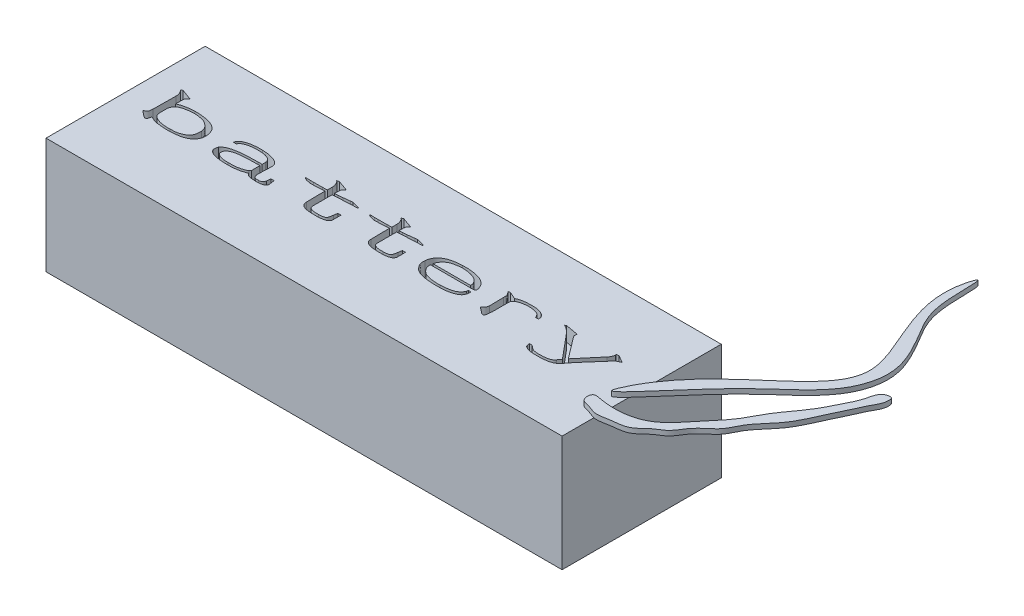
from build123d import *

# Parameters (mm, degrees)
SKETCH_1_W          = 107
SKETCH_1_H          = 33
EXTRUDE_1_DEPTH     = 24
EXTRUDE_2_DEPTH     = 1
CUT_EXTRUDE_1_DEPTH = 3


with BuildPart() as part:
    # 草图1 → 凸台-拉伸1 (new body)
    with BuildSketch(Plane(origin=(0, 0, 0), x_dir=(1, 0, 0), z_dir=(0, 1, 0))):
        Rectangle(SKETCH_1_W, SKETCH_1_H)
    extrude(amount=EXTRUDE_1_DEPTH)

    # 草图3 → 凸台-拉伸2 (add)
    with BuildSketch(Plane(origin=(0, 24, 0), x_dir=(1, 0, 0), z_dir=(0, 1, 0))):
        with BuildLine():
            add(Edge.make_bspline(
                [(52.795778293, -0.83675297), (59.844864524, 12.263734375), (85.832025443, 21.143971096), (65.671648546, 42.39713603), (69.977335362, 55.335078079), (69.598482649, 44.173440129), (72.431088504, 38.949802551), (78.487801167, 29.393472645), (75.530838449, 19.368679502), (66.103384067, 11.385991546), (61.050014322, 6.17936512), (49.979680642, -6.816970783), (52.092492679, -2.143785398), (52.795778293, -0.83675297)],
                knots=[0, 0, 0, 0, 0.257085536, 0.455034682, 0.465271925, 0.505328889, 0.579342725, 0.660886885, 0.722727264, 0.797250864, 0.913610995, 0.974350639, 1, 1, 1, 1], degree=3))
        make_face()
        with BuildLine():
            add(Edge.make_bspline(
                [(51.439943779, -6.787963002), (55.342352136, -7.517123566), (61.145035103, -6.954867424), (65.974307534, -0.566733036), (69.555996551, 3.342184148), (72.161897367, 8.878801404), (75.593409122, 12.731492289), (77.712546708, 17.384926835), (79.264043929, 20.20897008), (79.570462434, 23.095432505), (81.020764394, 23.573706878), (81.871270224, 23.706842843), (82.151942425, 21.731129555), (80.875315277, 20.134677165), (79.82026716, 17.376158755), (77.789063936, 13.552118806), (75.757271361, 7.95021169), (71.501657107, 4.184222408), (69.805439686, -0.173914348), (66.426467368, -2.056432107), (64.960788475, -5.494048863), (62.642985047, -6.624437368), (61.363396171, -7.921070397), (59.468831096, -9.500575575), (57.096869903, -9.46376914), (54.972932664, -9.945712676), (53.275468062, -10.070543491), (51.944508448, -9.212151302), (50.711041659, -9.10537921), (49.817582731, -8.411445786), (49.963897019, -6.482756841), (51.039417889, -6.713125195), (51.439943779, -6.787963002)],
                knots=[0, 0, 0, 0, 0.105259423, 0.165749622, 0.232821888, 0.265985133, 0.349341424, 0.387282205, 0.418309659, 0.451065362, 0.458174799, 0.464842638, 0.472483702, 0.506709597, 0.526789284, 0.56110242, 0.638059267, 0.703277407, 0.727657663, 0.776021908, 0.812732245, 0.8341436, 0.851342923, 0.868011488, 0.906931799, 0.918078239, 0.934531931, 0.956495227, 0.963717099, 0.971154977, 0.98919664, 1, 1, 1, 1], degree=3))
        make_face()
    extrude(amount=EXTRUDE_2_DEPTH)

    # 草图4 → 切除-拉伸1 (cut)
    # profile 1 of 7: a face of its own
    with BuildSketch(Plane(origin=(0, 24, 0), x_dir=(1, 0, 0), z_dir=(0, 1, 0))):
        with BuildLine():
            add(Edge.make_bspline(
                [(-46.315980853, -1.712589925), (-46.338242193, -1.764888924), (-46.379539331, -1.861909095), (-46.428689536, -2.000779299), (-46.457447372, -2.122520942), (-46.466603588, -2.227942485), (-46.468088336, -2.319821817), (-46.488491676, -2.401278121), (-46.521247955, -2.474029145), (-46.56240621, -2.538820816), (-46.616739613, -2.588262798), (-46.677084684, -2.624592555), (-46.747078199, -2.638250215), (-46.794095471, -2.633259754), (-46.818370913, -2.630683133)],
                knots=[0, 0, 0, 0, 1.772904811, 3.288925831, 4.591085337, 5.661310779, 6.585261859, 7.449842412, 8.256927572, 9.06945469, 9.823301038, 10.529723387, 11.240882905, 12, 12, 12, 12], degree=3))
            add(Edge.make_bspline(
                [(-46.818370913, -2.630683133), (-46.820991341, -2.629995072), (-46.831343531, -2.627276835), (-46.855338396, -2.624459925), (-46.89453847, -2.615462196), (-46.967586453, -2.601721587), (-47.068108463, -2.564642756), (-47.136176533, -2.510595074), (-47.171029034, -2.482921351)],
                knots=[0, 0, 0, 0, 0.125575752, 0.496096203, 1.11729126, 1.98943537, 3.946493689, 6, 6, 6, 6], degree=3))
            Line((-47.171029034, -2.482921351), (-47.421238986, -2.311517683))
            Line((-47.421238986, -2.311517683), (-48.12458507, -1.751993067))
            add(Edge.make_bspline(
                [(-48.12458507, -1.751993067), (-48.161381046, -1.722458398), (-48.225395345, -1.671076659), (-48.298856845, -1.598081398), (-48.347245439, -1.547692035), (-48.356500677, -1.49828505), (-48.328291878, -1.465395377), (-48.290721799, -1.433664652), (-48.239431973, -1.393172292), (-48.145021537, -1.336229072), (-48.019016746, -1.245090531), (-47.896028416, -1.139380805), (-47.809380559, -1.044361429), (-47.753583944, -0.976106472), (-47.717359814, -0.906126384), (-47.695456865, -0.829110891), (-47.683648452, -0.730136447), (-47.66500127, -0.593711093), (-47.643520623, -0.410488038), (-47.629821554, -0.272429105), (-47.62219501, -0.195568959)],
                knots=[0, 0, 0, 0, 1.309150132, 2.277540628, 2.891037881, 3.221713804, 3.550874015, 4.01637685, 4.615300949, 5.35471479, 7.082438118, 8.932324813, 9.849804258, 10.656905344, 11.375512208, 12.022595925, 12.872156994, 14.142666868, 15.852546144, 18, 18, 18, 18], degree=3))
            Line((-47.62219501, -0.195568959), (-47.572941082, 4.564330592))
            add(Edge.make_bspline(
                [(-47.572941082, 4.564330592), (-47.575322265, 4.665188265), (-47.579833525, 4.856267783), (-47.64147465, 5.127384711), (-47.730949766, 5.375437242), (-47.824445747, 5.568312263), (-47.905319548, 5.708230335), (-47.951143761, 5.79774945), (-47.990622069, 5.866331325), (-48.014208064, 5.905380129), (-48.024107058, 5.921768833)],
                knots=[0, 0, 0, 0, 1.664739368, 3.1539256, 4.572845527, 6.020534025, 6.69151302, 7.24546857, 7.68332469, 8, 8, 8, 8], degree=3))
            Line((-48.024107058, 5.921768833), (-48.276287167, 6.1345458))
            Line((-48.276287167, 6.1345458), (-47.823151034, 6.266546326))
            Line((-47.823151034, 6.266546326), (-45.612634769, 5.468632701))
            add(Edge.make_bspline(
                [(-45.612634769, 5.468632701), (-45.660111652, 5.426699286), (-45.750268398, 5.347069368), (-45.890278258, 5.238838143), (-46.018089576, 5.114577968), (-46.106656999, 4.982303833), (-46.164032554, 4.848551577), (-46.193689271, 4.718019233), (-46.213281939, 4.562962341), (-46.214730242, 4.450793448), (-46.215502841, 4.390956767)],
                knots=[0, 0, 0, 0, 1.167370995, 2.216791929, 3.261172925, 4.439727147, 5.123281863, 5.933685907, 6.897721357, 8, 8, 8, 8], degree=3))
            Line((-46.215502841, 4.390956767), (-46.215502841, 3.074891825))
            add(Edge.make_bspline(
                [(-46.215502841, 3.074891825), (-46.139858501, 3.105455761), (-45.971944068, 3.173301232), (-45.747519574, 3.270989584), (-45.516491934, 3.354536921), (-45.280581128, 3.426539502), (-44.987621307, 3.501844243), (-44.643101416, 3.58531474), (-44.250415043, 3.661468237), (-43.816659654, 3.723134309), (-43.344863676, 3.760507071), (-43.0179918, 3.773480941), (-42.848504359, 3.780208067)],
                knots=[0, 0, 0, 0, 0.706616079, 1.56853822, 2.119110147, 2.833353726, 3.703884378, 4.738579347, 5.903148453, 7.166825923, 8.53096133, 10, 10, 10, 10], degree=3))
            add(Edge.make_bspline(
                [(-42.848504359, 3.780208067), (-42.649473628, 3.781856437), (-42.255035108, 3.785123172), (-41.669735416, 3.749621063), (-41.096774798, 3.687565121), (-40.630847804, 3.609293309), (-40.271781059, 3.531258874), (-40.016795879, 3.473878751), (-39.777669911, 3.40762507), (-39.551954615, 3.342463153), (-39.343839475, 3.268256134), (-39.148925892, 3.194561454), (-38.970336157, 3.112942798), (-38.755683693, 3.006340331), (-38.520152736, 2.868985879), (-38.275140604, 2.701281968), (-38.074603196, 2.536263996), (-37.921881096, 2.360720901), (-37.796114068, 2.179372219), (-37.685878094, 1.981955814), (-37.583767022, 1.765439393), (-37.491562305, 1.530026143), (-37.413132417, 1.278767692), (-37.350666012, 1.013741689), (-37.313420842, 0.73524858), (-37.290571123, 0.448546301), (-37.291711218, 0.15828997), (-37.333157188, -0.127760659), (-37.403910651, -0.408167494), (-37.480628219, -0.585227618), (-37.519229406, -0.674317134)],
                knots=[0, 0, 0, 0, 1.975545378, 3.915130053, 5.817381957, 7.695298933, 8.601942458, 9.465456075, 10.289471349, 11.06509479, 11.797098768, 12.482403687, 13.133155347, 13.745472335, 14.861502225, 15.83631147, 16.692011666, 17.43109529, 18.138288337, 18.879869697, 19.67315892, 20.513419053, 21.387768748, 22.284512063, 23.213022305, 24.174129613, 25.139165318, 26.087045441, 27.037478389, 28, 28, 28, 28], degree=3))
            add(Edge.make_bspline(
                [(-37.519229406, -0.674317134), (-37.572114015, -0.768370133), (-37.676687833, -0.954350165), (-37.872665499, -1.20642572), (-38.096651251, -1.43039915), (-38.347759746, -1.625518627), (-38.621136424, -1.790952745), (-38.908359684, -1.938444393), (-39.212104958, -2.062747047), (-39.533219568, -2.162047686), (-39.869128292, -2.244259783), (-40.219801412, -2.312222313), (-40.585643966, -2.370423062), (-40.96253455, -2.411627178), (-41.338994635, -2.443021209), (-41.704969046, -2.462368738), (-42.055122538, -2.473133873), (-42.283719716, -2.471767671), (-42.395368226, -2.471100408)],
                knots=[0, 0, 0, 0, 0.946821189, 1.872240517, 2.794146846, 3.723101712, 4.658109279, 5.597236624, 6.557113699, 7.536893828, 8.547094745, 9.593622374, 10.673902707, 11.800243469, 12.923210794, 13.992016167, 15.019286222, 16, 16, 16, 16], degree=3))
            add(Edge.make_bspline(
                [(-42.395368226, -2.471100408), (-42.54841218, -2.469538431), (-42.85861573, -2.46637247), (-43.330378127, -2.44156932), (-43.81453966, -2.401928181), (-44.22173111, -2.357679983), (-44.54053976, -2.313078371), (-44.761532167, -2.278509046), (-44.961850562, -2.239139034), (-45.141826779, -2.197594965), (-45.301619404, -2.155774044), (-45.439985619, -2.107752597), (-45.559250831, -2.059905839), (-45.629340191, -2.02184711), (-45.661888696, -2.004173176)],
                knots=[0, 0, 0, 0, 1.658668106, 3.36194093, 5.118671966, 6.923369988, 7.800119057, 8.607530892, 9.347360781, 10.012094373, 10.609514821, 11.136224507, 11.598874906, 12, 12, 12, 12], degree=3))
            Line((-45.661888696, -2.004173176), (-46.315980853, -1.712589925))
        make_face()
        with BuildLine():
            add(Edge.make_bspline(
                [(-46.264756769, -0.035986234), (-46.264517125, -0.093838706), (-46.264053176, -0.205841124), (-46.245865218, -0.367316434), (-46.226775061, -0.517391167), (-46.193037891, -0.655713148), (-46.144353201, -0.785395807), (-46.079838425, -0.91031024), (-45.99232982, -1.029210547), (-45.88647526, -1.149353418), (-45.745105866, -1.265933619), (-45.563782534, -1.381067609), (-45.339397962, -1.497896408), (-45.077944136, -1.618481969), (-44.785787894, -1.731221223), (-44.472154572, -1.825291779), (-44.142921848, -1.900080434), (-43.798142, -1.956875393), (-43.435673018, -1.995672186), (-43.055050673, -2.018993658), (-42.655420185, -2.026594761), (-42.38288336, -2.020882309), (-42.243666129, -2.017964276)],
                knots=[0, 0, 0, 0, 0.689292554, 1.334470774, 1.935816662, 2.492302953, 3.027557294, 3.584484192, 4.162536561, 4.78359734, 5.489460419, 6.338737431, 7.340627001, 8.503949449, 9.770635974, 11.071240543, 12.404785865, 13.793873196, 15.235451237, 16.74972339, 18.339694061, 20, 20, 20, 20], degree=3))
            add(Edge.make_bspline(
                [(-42.243666129, -2.017964276), (-42.136590971, -2.016908093), (-41.92491879, -2.014820171), (-41.612856304, -1.995913329), (-41.309604793, -1.969685755), (-41.014964904, -1.927903515), (-40.724490331, -1.872192334), (-40.439453951, -1.790874486), (-40.158042219, -1.687219357), (-39.88324856, -1.565348286), (-39.625317969, -1.424960473), (-39.394184252, -1.268146495), (-39.19315431, -1.099645468), (-39.02617205, -0.913793419), (-38.887521186, -0.716512257), (-38.78537427, -0.502231324), (-38.709463868, -0.276192264), (-38.665546475, 0.03772906), (-38.634187668, 0.415102954), (-38.628942861, 0.713251848), (-38.626457696, 0.854524775)],
                knots=[0, 0, 0, 0, 1.07945318, 2.133923623, 3.151213363, 4.14753613, 5.133130334, 6.130860213, 7.132143007, 8.154698424, 9.15925975, 10.088531434, 10.966870054, 11.796647512, 12.601100282, 13.388811291, 14.182399994, 14.994446716, 16.575868246, 18, 18, 18, 18], degree=3))
            add(Edge.make_bspline(
                [(-38.626457696, 0.854524775), (-38.636758576, 0.946182269), (-38.656675794, 1.123406194), (-38.720977571, 1.374387963), (-38.806268909, 1.603084689), (-38.925260392, 1.80874349), (-39.070986957, 2.002294081), (-39.243559572, 2.194980673), (-39.450115888, 2.384948019), (-39.684367905, 2.575160466), (-39.948777022, 2.757062492), (-40.250550826, 2.906907582), (-40.582355314, 3.032509481), (-40.941508907, 3.124201908), (-41.314068011, 3.198042103), (-41.690854795, 3.253170588), (-42.06764007, 3.289821511), (-42.319110022, 3.297585018), (-42.444622154, 3.301459892)],
                knots=[0, 0, 0, 0, 0.886766497, 1.714603255, 2.486987939, 3.228656879, 3.992223533, 4.815826547, 5.714742169, 6.690057925, 7.71913229, 8.796144482, 9.924338822, 11.127906722, 12.358848346, 13.579032064, 14.791661409, 16, 16, 16, 16], degree=3))
            add(Edge.make_bspline(
                [(-42.444622154, 3.301459892), (-42.623977801, 3.298778699), (-42.972632261, 3.293566655), (-43.479954633, 3.254288443), (-43.955759481, 3.188022337), (-44.329298957, 3.109796112), (-44.607414367, 3.037978546), (-44.795370186, 2.982154457), (-44.968197461, 2.92988404), (-45.124043388, 2.874778435), (-45.263360591, 2.818077235), (-45.38631715, 2.760821621), (-45.49307364, 2.703936285), (-45.614055749, 2.628773918), (-45.74285456, 2.520001946), (-45.881627832, 2.375819862), (-45.997591523, 2.208864794), (-46.090101657, 2.029507855), (-46.162742378, 1.856833121), (-46.220065115, 1.70719921), (-46.254222773, 1.584266309), (-46.261587394, 1.510716731), (-46.264756769, 1.479064575)],
                knots=[0, 0, 0, 0, 2.325357788, 4.520328062, 6.592763197, 8.549990043, 9.46490639, 10.316405931, 11.092065462, 11.805752128, 12.458802872, 13.041629272, 13.563550566, 14.026581579, 14.885710438, 15.741033144, 16.61509649, 17.510184124, 18.353211674, 19.042873738, 19.588099474, 20, 20, 20, 20], degree=3))
            Line((-46.264756769, 1.479064575), (-46.264756769, -0.035986234))
        make_face(mode=Mode.SUBTRACT)
    # profile 2 of 7: a face of its own
    with BuildSketch(Plane(origin=(0, 24, 0), x_dir=(1, 0, 0), z_dir=(0, 1, 0))):
        with BuildLine():
            Line((-22.871111375, -0.489122367), (-22.217019218, -0.489122367))
            add(Edge.make_bspline(
                [(-22.217019218, -0.489122367), (-22.209648142, -0.532437323), (-22.195936208, -0.613013326), (-22.179037119, -0.725180571), (-22.171700811, -0.81937159), (-22.168970367, -0.875925313), (-22.167765291, -0.9008852)],
                knots=[0, 0, 0, 0, 1.270321599, 2.363096856, 3.277555622, 4, 4, 4, 4], degree=3))
            Line((-22.167765291, -0.9008852), (-22.067287279, -1.698798826))
            add(Edge.make_bspline(
                [(-22.067287279, -1.698798826), (-22.069313129, -1.738988292), (-22.073281734, -1.817718758), (-22.100403421, -1.931267163), (-22.149914163, -2.034142497), (-22.218164862, -2.132241479), (-22.327088869, -2.2188592), (-22.481930752, -2.29094011), (-22.684228732, -2.358697481), (-22.931567726, -2.417155253), (-23.212745179, -2.462872487), (-23.517334651, -2.494017586), (-23.840902256, -2.509977985), (-24.175542403, -2.506676704), (-24.50346454, -2.491670386), (-24.80826601, -2.465575048), (-25.082224242, -2.434076692), (-25.324010355, -2.38965692), (-25.532251028, -2.334552508), (-25.704343204, -2.264749631), (-25.841606948, -2.179744167), (-25.906557107, -2.105559473), (-25.936675821, -2.071158517)],
                knots=[0, 0, 0, 0, 0.554544918, 1.086343844, 1.597038661, 2.122626584, 2.721237962, 3.491115133, 4.468181419, 5.661454917, 6.993103929, 8.395933712, 9.883624887, 11.460180385, 13.011222913, 14.411504783, 15.680300313, 16.814059939, 17.801032354, 18.645752208, 19.372007666, 20, 20, 20, 20], degree=3))
            Line((-25.936675821, -2.071158517), (-26.18885593, -1.818978409))
            add(Edge.make_bspline(
                [(-26.18885593, -1.818978409), (-26.414125353, -1.896425987), (-26.878094785, -2.055938577), (-27.415699842, -2.209676079), (-27.800881835, -2.298624786), (-28.022275375, -2.340002415), (-28.265533893, -2.374791518), (-28.531079333, -2.403773089), (-28.818061542, -2.429660783), (-29.128147814, -2.449074801), (-29.459896855, -2.462280984), (-29.68850326, -2.468105265), (-29.806064363, -2.471100408)],
                knots=[0, 0, 0, 0, 1.932578683, 3.980377894, 4.532294502, 5.139442516, 5.80705343, 6.525480165, 7.306462626, 8.144671838, 9.045895386, 10, 10, 10, 10], degree=3))
            add(Edge.make_bspline(
                [(-29.806064363, -2.471100408), (-29.963680112, -2.473560564), (-30.275672882, -2.478430324), (-30.739588292, -2.46562688), (-31.194499205, -2.439348316), (-31.634606981, -2.393350832), (-32.050091756, -2.337744674), (-32.428205005, -2.26135567), (-32.767676607, -2.179424986), (-33.065127146, -2.079171931), (-33.323043163, -1.967751724), (-33.544674374, -1.853617128), (-33.729092624, -1.730710848), (-33.878907992, -1.600308905), (-33.993591434, -1.455270744), (-34.070959499, -1.293412564), (-34.119859561, -1.116627622), (-34.131682818, -0.927909613), (-34.125408767, -0.74013306), (-34.105737553, -0.56236468), (-34.075431224, -0.399141906), (-34.043530228, -0.297763831), (-34.028111027, -0.248763201)],
                knots=[0, 0, 0, 0, 1.668168946, 3.302059948, 4.910562789, 6.489480886, 7.984541388, 9.344915788, 10.570446142, 11.678211212, 12.662039313, 13.541897603, 14.312991836, 15.002174979, 15.636154712, 16.254745884, 16.888725616, 17.56520954, 18.246673955, 18.876065113, 19.456751202, 20, 20, 20, 20], degree=3))
            add(Edge.make_bspline(
                [(-34.028111027, -0.248763201), (-33.996646543, -0.202345532), (-33.926539212, -0.098920385), (-33.776870028, 0.044876263), (-33.580052743, 0.1929486), (-33.388210845, 0.323566697), (-33.205258239, 0.424252755), (-33.046842607, 0.50217569), (-32.869401059, 0.574060145), (-32.674085189, 0.642831038), (-32.460502112, 0.708088851), (-32.228644961, 0.767620454), (-31.979439383, 0.827925142), (-31.619868957, 0.90070231), (-31.149556554, 0.981627784), (-30.567683114, 1.05527442), (-29.967836401, 1.11163831), (-29.361019751, 1.141603001), (-28.773066614, 1.161049887), (-28.229350582, 1.18000962), (-27.742681587, 1.191510532), (-27.437281327, 1.196815414), (-27.294114062, 1.199302267)],
                knots=[0, 0, 0, 0, 0.474568784, 1.057406525, 1.748090082, 2.563665213, 3.022381192, 3.518049277, 4.059991523, 4.644794997, 5.273731974, 5.953209925, 6.674558467, 7.447869958, 9.06389936, 10.720418691, 12.420653509, 14.171976133, 15.871718322, 17.409663331, 18.785687298, 20, 20, 20, 20], degree=3))
            Line((-27.294114062, 1.199302267), (-26.389811954, 1.213093367))
            Line((-26.389811954, 1.213093367), (-26.389811954, 1.890827409))
            add(Edge.make_bspline(
                [(-26.389811954, 1.890827409), (-26.392359395, 1.94561894), (-26.397503372, 2.056257963), (-26.443314816, 2.218740414), (-26.515616354, 2.376501093), (-26.614444293, 2.527930486), (-26.7399112, 2.671029228), (-26.891506302, 2.800889481), (-27.070632785, 2.913232142), (-27.271370954, 3.013185299), (-27.494615327, 3.099004563), (-27.737450416, 3.172232235), (-27.999918693, 3.228207338), (-28.279636669, 3.270697898), (-28.576124717, 3.302368567), (-28.888400845, 3.320747514), (-29.216920028, 3.331749108), (-29.4409219, 3.328657962), (-29.555854412, 3.327071934)],
                knots=[0, 0, 0, 0, 0.685409922, 1.384029301, 2.09841458, 2.853891613, 3.641145785, 4.475663167, 5.345343854, 6.283744758, 7.281595889, 8.338532371, 9.458668871, 10.641090145, 11.882402854, 13.193357309, 14.559947325, 16, 16, 16, 16], degree=3))
            add(Edge.make_bspline(
                [(-29.555854412, 3.327071934), (-29.708282876, 3.32180335), (-30.001679059, 3.311662315), (-30.422444166, 3.276326081), (-30.806686757, 3.226198079), (-31.153672971, 3.158809209), (-31.46740982, 3.081104278), (-31.747780138, 2.988482954), (-31.997652622, 2.88514815), (-32.210485911, 2.770635706), (-32.383155445, 2.658537217), (-32.509845117, 2.561743567), (-32.595856098, 2.479826165), (-32.614271391, 2.42027225), (-32.621418858, 2.397157783)],
                knots=[0, 0, 0, 0, 1.661382121, 3.197848749, 4.598228732, 5.880699166, 7.046770766, 8.116910757, 9.094879633, 9.987930397, 10.747957822, 11.329014914, 11.739572752, 12, 12, 12, 12], degree=3))
            Line((-32.621418858, 2.397157783), (-32.670672785, 2.198171916))
            Line((-32.670672785, 2.198171916), (-33.324764942, 2.198171916))
            add(Edge.make_bspline(
                [(-33.324764942, 2.198171916), (-33.307648981, 2.269418784), (-33.275145377, 2.404718221), (-33.217637069, 2.568571141), (-33.151664665, 2.690451328), (-33.078100019, 2.781156103), (-32.984607574, 2.87550927), (-32.86930291, 2.975446282), (-32.725347533, 3.07605407), (-32.551956824, 3.177782939), (-32.34636467, 3.279579536), (-32.110408832, 3.387583298), (-31.833107969, 3.490039469), (-31.509478283, 3.573957409), (-31.139696537, 3.646462288), (-30.730374876, 3.702967357), (-30.295914772, 3.746966137), (-29.851155286, 3.779015428), (-29.40295989, 3.794829017), (-29.103384987, 3.794276535), (-28.95298634, 3.793999166)],
                knots=[0, 0, 0, 0, 0.793019384, 1.505962021, 1.871857422, 2.287039429, 2.764532067, 3.308822868, 3.935961165, 4.662486219, 5.482595977, 6.417910767, 7.470294436, 8.677194744, 10.032117459, 11.546942094, 13.147455834, 14.757834863, 16.372302725, 18, 18, 18, 18], degree=3))
            add(Edge.make_bspline(
                [(-28.95298634, 3.793999166), (-28.759122264, 3.785450729), (-28.385175297, 3.768961534), (-27.847218648, 3.713563979), (-27.352761728, 3.636592004), (-26.905522168, 3.533447601), (-26.507122214, 3.419396425), (-26.162756052, 3.294469396), (-25.873867548, 3.160877945), (-25.641614307, 3.012724745), (-25.454715425, 2.860250262), (-25.304007595, 2.707341905), (-25.186562082, 2.552269123), (-25.102753338, 2.391416278), (-25.047461736, 2.219130479), (-25.008644342, 2.030892668), (-24.985211431, 1.821801073), (-24.982541093, 1.675486203), (-24.981149628, 1.599244158)],
                knots=[0, 0, 0, 0, 1.835377809, 3.540284414, 5.113160953, 6.565980385, 7.879301108, 9.031077099, 10.028679783, 10.883478511, 11.629624022, 12.306186587, 12.910045613, 13.462992018, 14.013069226, 14.616192794, 15.278922978, 16, 16, 16, 16], degree=3))
            Line((-24.981149628, 1.599244158), (-25.08162764, -1.007273684))
            add(Edge.make_bspline(
                [(-25.08162764, -1.007273684), (-25.076831458, -1.105646201), (-25.067445277, -1.298162268), (-25.00282764, -1.528305965), (-24.929749507, -1.695079365), (-24.852012154, -1.798602805), (-24.762874732, -1.887374126), (-24.653973571, -1.959573584), (-24.517872376, -2.011415036), (-24.350656095, -2.041938296), (-24.150121882, -2.059311126), (-24.005306548, -2.058048925), (-23.92711558, -2.057367418)],
                knots=[0, 0, 0, 0, 1.609883931, 3.150560068, 3.887303667, 4.580539411, 5.257968739, 5.941611973, 6.705152142, 7.627633235, 8.719074509, 10, 10, 10, 10], degree=3))
            add(Edge.make_bspline(
                [(-23.92711558, -2.057367418), (-23.87848493, -2.056832123), (-23.785600331, -2.055809709), (-23.652401819, -2.04207696), (-23.53249386, -2.01844875), (-23.423365228, -1.987448139), (-23.323717494, -1.943068782), (-23.238881628, -1.874649778), (-23.159402674, -1.793553483), (-23.07739337, -1.661697175), (-22.990474147, -1.503308092), (-22.942069628, -1.371672654), (-22.920365302, -1.312648034)],
                knots=[0, 0, 0, 0, 1.05847059, 2.0216801, 2.910601303, 3.715896493, 4.489863284, 5.264885964, 6.073980335, 6.950393946, 8.632573114, 10, 10, 10, 10], degree=3))
            Line((-22.920365302, -1.312648034), (-22.871111375, -0.489122367))
        make_face()
        with BuildLine():
            Line((-26.389811954, -1.034855883), (-26.389811954, 0.748136291))
            add(Edge.make_bspline(
                [(-26.389811954, 0.748136291), (-26.645278564, 0.747703498), (-27.164755707, 0.746823438), (-27.825407169, 0.742171271), (-28.387122313, 0.734784031), (-28.855302239, 0.710360088), (-29.367820366, 0.680744012), (-29.81665017, 0.641491912), (-30.182824535, 0.610684842), (-30.44528464, 0.577806974), (-30.690945631, 0.544596551), (-30.919999831, 0.510417903), (-31.130835785, 0.468865535), (-31.324357578, 0.422929205), (-31.501678408, 0.37690197), (-31.709447137, 0.310053412), (-31.9383863, 0.2179879), (-32.182005823, 0.099904786), (-32.383357604, -0.0326713), (-32.546371892, -0.175148114), (-32.672480204, -0.33050046), (-32.763880149, -0.498522925), (-32.826317986, -0.677968088), (-32.855009296, -0.86584831), (-32.841489534, -1.055792576), (-32.772009805, -1.236521005), (-32.642598799, -1.396293831), (-32.529678063, -1.480637971), (-32.469716761, -1.525425001)],
                knots=[0, 0, 0, 0, 2.524534066, 5.13349962, 6.5290445, 8.075261772, 9.765797395, 11.60199326, 12.527396316, 13.396760873, 14.215451609, 14.977275885, 15.684930147, 16.338209933, 16.942701116, 17.494790613, 18.493837905, 19.379045306, 20.165622041, 20.868948101, 21.51051825, 22.13204843, 22.749806268, 23.379415603, 23.998127192, 24.610372129, 25.262102786, 26, 26, 26, 26], degree=3))
            add(Edge.make_bspline(
                [(-32.469716761, -1.525425001), (-32.408429545, -1.569874365), (-32.283803378, -1.660261142), (-32.071875937, -1.765272495), (-31.840313682, -1.851021064), (-31.584516351, -1.910459526), (-31.304451144, -1.953155635), (-30.997105384, -1.980619128), (-30.662062179, -2.001895763), (-30.429329966, -2.003394676), (-30.308454424, -2.004173176)],
                knots=[0, 0, 0, 0, 0.804838375, 1.636620621, 2.508182637, 3.429030509, 4.426829231, 5.522610214, 6.713303036, 8, 8, 8, 8], degree=3))
            add(Edge.make_bspline(
                [(-30.308454424, -2.004173176), (-30.204035536, -2.005356602), (-29.988615246, -2.007798055), (-29.654252786, -2.001148863), (-29.298270818, -1.986923042), (-28.924881422, -1.966972883), (-28.546093235, -1.932541572), (-28.174529683, -1.87025116), (-27.815565722, -1.788533597), (-27.528724629, -1.700423902), (-27.312575854, -1.625252479), (-27.169087097, -1.566753799), (-27.03994726, -1.514689281), (-26.927284933, -1.461749862), (-26.831801344, -1.408742266), (-26.751250988, -1.35959718), (-26.687279648, -1.311713833), (-26.654690932, -1.275675556), (-26.640021905, -1.259453793)],
                knots=[0, 0, 0, 0, 1.315758889, 2.714462575, 4.213366216, 5.804781082, 7.426057362, 9.002774614, 10.548415638, 12.061505663, 12.781244712, 13.431244449, 14.013680972, 14.535599829, 14.998559082, 15.388892385, 15.724924609, 16, 16, 16, 16], degree=3))
            Line((-26.640021905, -1.259453793), (-26.389811954, -1.034855883))
        make_face(mode=Mode.SUBTRACT)
    # profile 3 of 7: a face of its own
    with BuildSketch(Plane(origin=(0, 24, 0), x_dir=(1, 0, 0), z_dir=(0, 1, 0))):
        with BuildLine():
            add(Edge.make_bspline(
                [(-13.670477723, 3.461042617), (-13.626488031, 3.461604549), (-13.551615413, 3.462560985), (-13.458142274, 3.464780764), (-13.378912591, 3.474427462), (-13.288897306, 3.483746647), (-13.164154394, 3.497897501), (-13.069582344, 3.50835469), (-13.016385566, 3.514236858)],
                knots=[0, 0, 0, 0, 1.206011228, 2.052690422, 2.559523294, 3.392315236, 4.53317732, 6, 6, 6, 6], degree=3))
            Line((-13.016385566, 3.514236858), (-12.06282953, 3.593043142))
            add(Edge.make_bspline(
                [(-12.06282953, 3.593043142), (-11.938680025, 3.603197259), (-11.678346451, 3.624489792), (-11.351930368, 3.657081076), (-11.092801869, 3.688472388), (-10.921182999, 3.709268233), (-10.778045068, 3.730791722), (-10.692232839, 3.745916593), (-10.654167204, 3.752625867)],
                knots=[0, 0, 0, 0, 1.581025803, 3.315310043, 4.163106763, 4.894060102, 5.509413688, 6, 6, 6, 6], degree=3))
            Line((-10.654167204, 3.752625867), (-10.203001228, 3.833402308))
            Line((-10.203001228, 3.833402308), (-8.745084975, 3.461042617))
            add(Edge.make_bspline(
                [(-8.745084975, 3.461042617), (-8.715258506, 3.451181266), (-8.663361119, 3.434022738), (-8.599921478, 3.404455682), (-8.557891607, 3.379886787), (-8.536887032, 3.341094491), (-8.567331963, 3.29540609), (-8.614964833, 3.266987973), (-8.681529879, 3.251345714), (-8.761679959, 3.239907254), (-8.870503108, 3.235582253), (-8.951963868, 3.234870413), (-8.997265084, 3.23447455)],
                knots=[0, 0, 0, 0, 1.28593844, 2.237504087, 2.872959574, 3.258468525, 3.88473068, 4.818220895, 5.543201752, 6.658889551, 8.141972098, 10, 10, 10, 10], degree=3))
            Line((-8.997265084, 3.23447455), (-9.749865096, 3.208862508))
            add(Edge.make_bspline(
                [(-9.749865096, 3.208862508), (-9.858236683, 3.204540241), (-10.081596303, 3.195631819), (-10.426243052, 3.176468879), (-10.791447117, 3.15948493), (-11.17700132, 3.140159111), (-11.58279366, 3.116029985), (-12.008920866, 3.089679092), (-12.45565312, 3.065481222), (-12.760282623, 3.045630002), (-12.915907554, 3.035488683)],
                knots=[0, 0, 0, 0, 0.820898972, 1.691916543, 2.612578791, 3.588098128, 4.613792853, 5.689401256, 6.819593089, 8, 8, 8, 8], degree=3))
            Line((-12.915907554, 3.035488683), (-13.670477723, 2.996085541))
            Line((-13.670477723, 2.996085541), (-13.670477723, -0.861482059))
            add(Edge.make_bspline(
                [(-13.670477723, -0.861482059), (-13.670203675, -0.91144987), (-13.669682821, -1.00641848), (-13.65282802, -1.141361329), (-13.629567164, -1.261925378), (-13.599461289, -1.370062894), (-13.555828974, -1.462569043), (-13.504217856, -1.54167305), (-13.442348254, -1.606382186), (-13.344541861, -1.671852802), (-13.207153807, -1.732600071), (-13.032789228, -1.801505903), (-12.842184039, -1.857604438), (-12.633020253, -1.903705731), (-12.398780644, -1.938261759), (-12.132634649, -1.9523553), (-11.832326038, -1.962547105), (-11.620856916, -1.954975981), (-11.509215385, -1.950978934)],
                knots=[0, 0, 0, 0, 0.85798997, 1.63069207, 2.33229766, 2.967899113, 3.553546848, 4.082519622, 4.585323417, 5.079955149, 6.094515099, 7.159180878, 8.301744057, 9.503788546, 10.8380496, 12.364965159, 14.080945098, 16, 16, 16, 16], degree=3))
            add(Edge.make_bspline(
                [(-11.509215385, -1.950978934), (-11.399478648, -1.94761479), (-11.194102409, -1.941318672), (-10.907754959, -1.914388392), (-10.66494621, -1.874672366), (-10.462476327, -1.821214586), (-10.297338203, -1.747087553), (-10.168063078, -1.64665467), (-10.075651565, -1.519961662), (-10.022150846, -1.368090849), (-9.986876629, -1.19447762), (-9.942131748, -0.99720792), (-9.897747017, -0.771615407), (-9.866736079, -0.612589585), (-9.850343108, -0.528525509)],
                knots=[0, 0, 0, 0, 1.537544453, 2.877569596, 4.025391031, 4.980647448, 5.803668023, 6.543526408, 7.248239077, 7.967451569, 8.779657094, 9.730518647, 10.800308961, 12, 12, 12, 12], degree=3))
            Line((-9.850343108, -0.528525509), (-9.749865096, 0.269388116))
            Line((-9.749865096, 0.269388116), (-9.097743096, 0.269388116))
            Line((-9.097743096, 0.269388116), (-9.097743096, -0.514734409))
            add(Edge.make_bspline(
                [(-9.097743096, -0.514734409), (-9.097803094, -0.617840708), (-9.097913537, -0.807635106), (-9.097227436, -1.068336427), (-9.099147946, -1.280501839), (-9.094049062, -1.452163998), (-9.109500864, -1.601193658), (-9.164172373, -1.739290613), (-9.253603289, -1.871701652), (-9.375447452, -2.001664197), (-9.538077705, -2.121742255), (-9.746956064, -2.219736461), (-9.997037674, -2.303454709), (-10.289935013, -2.371355436), (-10.624634867, -2.421206228), (-11.001051609, -2.452542694), (-11.417695636, -2.473483122), (-11.709486456, -2.471917862), (-11.861873506, -2.471100408)],
                knots=[0, 0, 0, 0, 1.195337571, 2.200334765, 3.022605196, 3.654535249, 4.191875271, 4.746154817, 5.356432493, 6.035112723, 6.802578721, 7.684477269, 8.698117968, 9.856013414, 11.165378138, 12.61774382, 14.233624888, 16, 16, 16, 16], degree=3))
            add(Edge.make_bspline(
                [(-11.861873506, -2.471100408), (-11.959732549, -2.470950166), (-12.149575136, -2.470658702), (-12.42606912, -2.461901751), (-12.686254679, -2.450975841), (-12.930678176, -2.433396586), (-13.158587482, -2.409692658), (-13.370101462, -2.382014868), (-13.564960838, -2.351650426), (-13.795442284, -2.302604013), (-14.053170443, -2.231275627), (-14.32413002, -2.11680548), (-14.550787572, -1.982662111), (-14.730218458, -1.820934254), (-14.865151094, -1.635116131), (-14.960570298, -1.427606691), (-15.016801048, -1.197357394), (-15.024120835, -1.037145397), (-15.027915964, -0.954079442)],
                knots=[0, 0, 0, 0, 1.191953827, 2.312342243, 3.369367836, 4.363916382, 5.296811537, 6.160054665, 6.962282281, 7.698106759, 9.029875017, 10.212612777, 11.271755145, 12.223125265, 13.13355947, 14.049843887, 14.98889232, 16, 16, 16, 16], degree=3))
            Line((-15.027915964, -0.954079442), (-15.077169891, 2.9153091))
            Line((-15.077169891, 2.9153091), (-17.993002398, 2.755726375))
            add(Edge.make_bspline(
                [(-17.993002398, 2.755726375), (-18.074414269, 2.773551271), (-18.231323587, 2.807906116), (-18.459693394, 2.856317621), (-18.671443132, 2.906518495), (-18.866881797, 2.951134503), (-19.038883354, 3.000560356), (-19.186111893, 3.047937765), (-19.305205225, 3.100819634), (-19.396040958, 3.154515364), (-19.459261403, 3.206924977), (-19.497606145, 3.24339481), (-19.520276687, 3.279057404), (-19.488684342, 3.317834858), (-19.407843931, 3.323411615), (-19.340498442, 3.334230935), (-19.299216554, 3.340863034)],
                knots=[0, 0, 0, 0, 1.872653096, 3.609261327, 5.245080298, 6.76261171, 8.112549492, 9.265146481, 10.236038121, 11.030688267, 11.639105391, 12.046175578, 12.284570622, 12.444184224, 13.046305658, 14, 14, 14, 14], degree=3))
            Line((-19.299216554, 3.340863034), (-18.546616543, 3.315250991))
            Line((-18.546616543, 3.315250991), (-17.841300301, 3.315250991))
            add(Edge.make_bspline(
                [(-17.841300301, 3.315250991), (-17.743448254, 3.315465275), (-17.552995632, 3.315882341), (-17.275211202, 3.312938561), (-17.013159851, 3.312350075), (-16.768239259, 3.306208954), (-16.541656634, 3.307556237), (-16.336009814, 3.307607435), (-16.152131756, 3.31636916), (-16.037283437, 3.32365589), (-15.983442157, 3.327071934)],
                knots=[0, 0, 0, 0, 1.263693977, 2.459568689, 3.587595868, 4.647877512, 5.62321179, 6.513774777, 7.303252593, 8, 8, 8, 8], degree=3))
            Line((-15.983442157, 3.327071934), (-15.027915964, 3.380266176))
            Line((-15.027915964, 3.380266176), (-15.027915964, 4.404747867))
            add(Edge.make_bspline(
                [(-15.027915964, 4.404747867), (-15.030289438, 4.505609781), (-15.034786094, 4.696697334), (-15.096526393, 4.967759699), (-15.185648249, 5.216006586), (-15.280492185, 5.408797149), (-15.359649735, 5.550315297), (-15.407122852, 5.640896408), (-15.446420194, 5.712838304), (-15.469256176, 5.755605413), (-15.47908194, 5.774007051)],
                knots=[0, 0, 0, 0, 1.652992054, 3.13166977, 4.540577019, 5.978049833, 6.653742316, 7.203788852, 7.657409875, 8, 8, 8, 8], degree=3))
            Line((-15.47908194, 5.774007051), (-15.731262048, 5.986784018))
            Line((-15.731262048, 5.986784018), (-15.278125915, 6.1207547))
            Line((-15.278125915, 6.1207547), (-13.06760965, 5.322841075))
            add(Edge.make_bspline(
                [(-13.06760965, 5.322841075), (-13.126609637, 5.278957969), (-13.230754917, 5.201496624), (-13.369166141, 5.083068703), (-13.477714082, 4.951985087), (-13.552682541, 4.841629799), (-13.598061059, 4.744285377), (-13.615037649, 4.668518547), (-13.633521296, 4.57413346), (-13.646027945, 4.458095508), (-13.658152436, 4.321545374), (-13.665564756, 4.163802352), (-13.668953728, 3.985777632), (-13.66995062, 3.860329453), (-13.670477723, 3.793999166)],
                knots=[0, 0, 0, 0, 1.513629673, 2.671820712, 3.736000892, 5.006749245, 5.406041992, 5.93705841, 6.59703494, 7.386535504, 8.335985016, 9.418456534, 10.635017888, 12, 12, 12, 12], degree=3))
            Line((-13.670477723, 3.793999166), (-13.670477723, 3.461042617))
        make_face()
    # profile 4 of 7: a face of its own
    with BuildSketch(Plane(origin=(0, 24, 0), x_dir=(1, 0, 0), z_dir=(0, 1, 0))):
        with BuildLine():
            add(Edge.make_bspline(
                [(-0.304931963, 3.461042617), (-0.260942272, 3.461604549), (-0.186069653, 3.462560985), (-0.092596514, 3.464780764), (-0.013366831, 3.474427462), (0.076648454, 3.483746647), (0.201391365, 3.497897501), (0.295963416, 3.50835469), (0.349160194, 3.514236858)],
                knots=[0, 0, 0, 0, 1.206011228, 2.052690422, 2.559523294, 3.392315236, 4.53317732, 6, 6, 6, 6], degree=3))
            Line((0.349160194, 3.514236858), (1.30271623, 3.593043142))
            add(Edge.make_bspline(
                [(1.30271623, 3.593043142), (1.426865734, 3.603197259), (1.687199309, 3.624489792), (2.013615392, 3.657081076), (2.27274389, 3.688472388), (2.44436276, 3.709268233), (2.587500692, 3.730791722), (2.67331292, 3.745916593), (2.711378556, 3.752625867)],
                knots=[0, 0, 0, 0, 1.581025803, 3.315310043, 4.163106763, 4.894060102, 5.509413688, 6, 6, 6, 6], degree=3))
            Line((2.711378556, 3.752625867), (3.162544531, 3.833402308))
            Line((3.162544531, 3.833402308), (4.620460785, 3.461042617))
            add(Edge.make_bspline(
                [(4.620460785, 3.461042617), (4.650287253, 3.451181266), (4.702184641, 3.434022738), (4.765624281, 3.404455682), (4.807654153, 3.379886787), (4.828658728, 3.341094491), (4.798213796, 3.29540609), (4.750580927, 3.266987973), (4.684015881, 3.251345714), (4.603865801, 3.239907254), (4.495042652, 3.235582253), (4.413581892, 3.234870413), (4.368280676, 3.23447455)],
                knots=[0, 0, 0, 0, 1.28593844, 2.237504087, 2.872959574, 3.258468525, 3.88473068, 4.818220895, 5.543201752, 6.658889551, 8.141972098, 10, 10, 10, 10], degree=3))
            Line((4.368280676, 3.23447455), (3.615680664, 3.208862508))
            add(Edge.make_bspline(
                [(3.615680664, 3.208862508), (3.507309076, 3.204540241), (3.283949457, 3.195631819), (2.939302707, 3.176468879), (2.574098643, 3.15948493), (2.188544439, 3.140159111), (1.782752099, 3.116029985), (1.356624893, 3.089679092), (0.90989264, 3.065481222), (0.605263137, 3.045630002), (0.449638206, 3.035488683)],
                knots=[0, 0, 0, 0, 0.820898972, 1.691916543, 2.612578791, 3.588098128, 4.613792853, 5.689401256, 6.819593089, 8, 8, 8, 8], degree=3))
            Line((0.449638206, 3.035488683), (-0.304931963, 2.996085541))
            Line((-0.304931963, 2.996085541), (-0.304931963, -0.861482059))
            add(Edge.make_bspline(
                [(-0.304931963, -0.861482059), (-0.304657915, -0.91144987), (-0.304137062, -1.00641848), (-0.28728226, -1.141361329), (-0.264021404, -1.261925378), (-0.233915529, -1.370062894), (-0.190283214, -1.462569043), (-0.138672096, -1.54167305), (-0.076802495, -1.606382186), (0.021003899, -1.671852802), (0.158391953, -1.732600071), (0.332756531, -1.801505903), (0.523361721, -1.857604438), (0.732525507, -1.903705731), (0.966765116, -1.938261759), (1.232911111, -1.9523553), (1.533219721, -1.962547105), (1.744688844, -1.954975981), (1.856330375, -1.950978934)],
                knots=[0, 0, 0, 0, 0.85798997, 1.63069207, 2.33229766, 2.967899113, 3.553546848, 4.082519622, 4.585323417, 5.079955149, 6.094515099, 7.159180878, 8.301744057, 9.503788546, 10.8380496, 12.364965159, 14.080945098, 16, 16, 16, 16], degree=3))
            add(Edge.make_bspline(
                [(1.856330375, -1.950978934), (1.966067112, -1.94761479), (2.171443351, -1.941318672), (2.4577908, -1.914388392), (2.70059955, -1.874672366), (2.903069433, -1.821214586), (3.068207556, -1.747087553), (3.197482681, -1.64665467), (3.289894194, -1.519961662), (3.343394914, -1.368090849), (3.378669131, -1.19447762), (3.423414011, -0.99720792), (3.467798743, -0.771615407), (3.49880968, -0.612589585), (3.515202652, -0.528525509)],
                knots=[0, 0, 0, 0, 1.537544453, 2.877569596, 4.025391031, 4.980647448, 5.803668023, 6.543526408, 7.248239077, 7.967451569, 8.779657094, 9.730518647, 10.800308961, 12, 12, 12, 12], degree=3))
            Line((3.515202652, -0.528525509), (3.615680664, 0.269388116))
            Line((3.615680664, 0.269388116), (4.267802664, 0.269388116))
            Line((4.267802664, 0.269388116), (4.267802664, -0.514734409))
            add(Edge.make_bspline(
                [(4.267802664, -0.514734409), (4.267742666, -0.617840708), (4.267632223, -0.807635106), (4.268318324, -1.068336427), (4.266397813, -1.280501839), (4.271496698, -1.452163998), (4.256044896, -1.601193658), (4.201373386, -1.739290613), (4.11194247, -1.871701652), (3.990098307, -2.001664197), (3.827468055, -2.121742255), (3.618589695, -2.219736461), (3.368508086, -2.303454709), (3.075610746, -2.371355436), (2.740910893, -2.421206228), (2.36449415, -2.452542694), (1.947850123, -2.473483122), (1.656059304, -2.471917862), (1.503672254, -2.471100408)],
                knots=[0, 0, 0, 0, 1.195337571, 2.200334765, 3.022605196, 3.654535249, 4.191875271, 4.746154817, 5.356432493, 6.035112723, 6.802578721, 7.684477269, 8.698117968, 9.856013414, 11.165378138, 12.61774382, 14.233624888, 16, 16, 16, 16], degree=3))
            add(Edge.make_bspline(
                [(1.503672254, -2.471100408), (1.405813211, -2.470950166), (1.215970624, -2.470658702), (0.939476639, -2.461901751), (0.679291081, -2.450975841), (0.434867583, -2.433396586), (0.206958277, -2.409692658), (-0.004555702, -2.382014868), (-0.199415078, -2.351650426), (-0.429896525, -2.302604013), (-0.687624683, -2.231275627), (-0.95858426, -2.11680548), (-1.185241813, -1.982662111), (-1.364672698, -1.820934254), (-1.499605335, -1.635116131), (-1.595024539, -1.427606691), (-1.651255288, -1.197357394), (-1.658575075, -1.037145397), (-1.662370204, -0.954079442)],
                knots=[0, 0, 0, 0, 1.191953827, 2.312342243, 3.369367836, 4.363916382, 5.296811537, 6.160054665, 6.962282281, 7.698106759, 9.029875017, 10.212612777, 11.271755145, 12.223125265, 13.13355947, 14.049843887, 14.98889232, 16, 16, 16, 16], degree=3))
            Line((-1.662370204, -0.954079442), (-1.711624132, 2.9153091))
            Line((-1.711624132, 2.9153091), (-4.627456638, 2.755726375))
            add(Edge.make_bspline(
                [(-4.627456638, 2.755726375), (-4.70886851, 2.773551271), (-4.865777828, 2.807906116), (-5.094147635, 2.856317621), (-5.305897373, 2.906518495), (-5.501336038, 2.951134503), (-5.673337595, 3.000560356), (-5.820566133, 3.047937765), (-5.939659466, 3.100819634), (-6.030495199, 3.154515364), (-6.093715644, 3.206924977), (-6.132060385, 3.24339481), (-6.154730927, 3.279057404), (-6.123138583, 3.317834858), (-6.042298171, 3.323411615), (-5.974952682, 3.334230935), (-5.933670795, 3.340863034)],
                knots=[0, 0, 0, 0, 1.872653096, 3.609261327, 5.245080298, 6.76261171, 8.112549492, 9.265146481, 10.236038121, 11.030688267, 11.639105391, 12.046175578, 12.284570622, 12.444184224, 13.046305658, 14, 14, 14, 14], degree=3))
            Line((-5.933670795, 3.340863034), (-5.181070783, 3.315250991))
            Line((-5.181070783, 3.315250991), (-4.475754542, 3.315250991))
            add(Edge.make_bspline(
                [(-4.475754542, 3.315250991), (-4.377902494, 3.315465275), (-4.187449872, 3.315882341), (-3.909665443, 3.312938561), (-3.647614091, 3.312350075), (-3.4026935, 3.306208954), (-3.176110874, 3.307556237), (-2.970464054, 3.307607435), (-2.786585996, 3.31636916), (-2.671737677, 3.32365589), (-2.617896397, 3.327071934)],
                knots=[0, 0, 0, 0, 1.263693977, 2.459568689, 3.587595868, 4.647877512, 5.62321179, 6.513774777, 7.303252593, 8, 8, 8, 8], degree=3))
            Line((-2.617896397, 3.327071934), (-1.662370204, 3.380266176))
            Line((-1.662370204, 3.380266176), (-1.662370204, 4.404747867))
            add(Edge.make_bspline(
                [(-1.662370204, 4.404747867), (-1.664743678, 4.505609781), (-1.669240335, 4.696697334), (-1.730980633, 4.967759699), (-1.820102489, 5.216006586), (-1.914946425, 5.408797149), (-1.994103975, 5.550315297), (-2.041577092, 5.640896408), (-2.080874434, 5.712838304), (-2.103710417, 5.755605413), (-2.11353618, 5.774007051)],
                knots=[0, 0, 0, 0, 1.652992054, 3.13166977, 4.540577019, 5.978049833, 6.653742316, 7.203788852, 7.657409875, 8, 8, 8, 8], degree=3))
            Line((-2.11353618, 5.774007051), (-2.365716289, 5.986784018))
            Line((-2.365716289, 5.986784018), (-1.912580156, 6.1207547))
            Line((-1.912580156, 6.1207547), (0.297936109, 5.322841075))
            add(Edge.make_bspline(
                [(0.297936109, 5.322841075), (0.238936123, 5.278957969), (0.134790843, 5.201496624), (-0.003620381, 5.083068703), (-0.112168323, 4.951985087), (-0.187136781, 4.841629799), (-0.232515299, 4.744285377), (-0.24949189, 4.668518547), (-0.267975536, 4.57413346), (-0.280482185, 4.458095508), (-0.292606676, 4.321545374), (-0.300018996, 4.163802352), (-0.303407969, 3.985777632), (-0.30440486, 3.860329453), (-0.304931963, 3.793999166)],
                knots=[0, 0, 0, 0, 1.513629673, 2.671820712, 3.736000892, 5.006749245, 5.406041992, 5.93705841, 6.59703494, 7.386535504, 8.335985016, 9.418456534, 10.635017888, 12, 12, 12, 12], degree=3))
            Line((-0.304931963, 3.793999166), (-0.304931963, 3.461042617))
        make_face()
    # profile 5 of 7: a face of its own
    with BuildSketch(Plane(origin=(0, 24, 0), x_dir=(1, 0, 0), z_dir=(0, 1, 0))):
        with BuildLine():
            add(Edge.make_bspline(
                [(9.090747242, 0.614165609), (9.095036937, 0.493872396), (9.103382366, 0.259846811), (9.146143322, -0.03110351), (9.217171086, -0.259474892), (9.304594518, -0.439177813), (9.421847002, -0.630045575), (9.567349343, -0.828360421), (9.740558241, -1.022513321), (9.936873877, -1.205743641), (10.156435364, -1.370742574), (10.401317199, -1.522680439), (10.685714081, -1.654892235), (11.020021518, -1.76498726), (11.406038398, -1.860377693), (11.838023992, -1.936285967), (12.300858739, -1.995077346), (12.780307067, -2.029162124), (13.269415761, -2.044256989), (13.597813379, -2.035955404), (13.763959881, -2.031755375)],
                knots=[0, 0, 0, 0, 1.0699213, 2.081488652, 2.602138912, 3.189706755, 3.852502566, 4.591608197, 5.373117975, 6.16209278, 6.974729731, 7.810766809, 8.719617889, 9.755290205, 10.934724731, 12.251597807, 13.652001734, 15.080309023, 16.522838126, 18, 18, 18, 18], degree=3))
            add(Edge.make_bspline(
                [(13.763959881, -2.031755375), (13.996676778, -2.022589136), (14.458843448, -2.004385341), (15.028135442, -1.933265178), (15.464957491, -1.858422778), (15.767520011, -1.791676409), (16.044228816, -1.715013433), (16.299307405, -1.63133547), (16.533633253, -1.52774946), (16.751048941, -1.401898231), (16.951768573, -1.250646869), (17.131988867, -1.078283564), (17.291039488, -0.897936673), (17.419483621, -0.714891207), (17.523120656, -0.538015128), (17.564327652, -0.414433388), (17.584094496, -0.355151684)],
                knots=[0, 0, 0, 0, 2.201276769, 4.371649713, 5.418014169, 6.391220963, 7.299614274, 8.132177905, 8.927194085, 9.717418842, 10.502282762, 11.297298942, 12.071852662, 12.771308737, 13.410601341, 14, 14, 14, 14], degree=3))
            Line((17.584094496, -0.355151684), (17.633348423, -0.063568433))
            Line((17.633348423, -0.063568433), (18.186962568, -0.063568433))
            add(Edge.make_bspline(
                [(18.186962568, -0.063568433), (18.184966479, -0.168090886), (18.181047101, -0.373323748), (18.148140126, -0.627573563), (18.103904284, -0.826366999), (18.056133169, -0.978377666), (17.990271447, -1.132670884), (17.910430997, -1.293497949), (17.797922554, -1.457314209), (17.633947186, -1.61088201), (17.426384068, -1.76358305), (17.173478865, -1.907539374), (16.88383543, -2.045308557), (16.558816455, -2.16423832), (16.203283763, -2.268036523), (15.885381154, -2.341387269), (15.609897507, -2.390450792), (15.382639595, -2.423962053), (15.138071168, -2.450672516), (14.876671587, -2.474611589), (14.598133657, -2.493730167), (14.301963415, -2.510100511), (13.988604635, -2.519250646), (13.773814698, -2.52258293), (13.663481869, -2.52429465)],
                knots=[0, 0, 0, 0, 1.181272436, 2.319462628, 2.890394922, 3.482091686, 4.11770932, 4.785094414, 5.510076158, 6.350083073, 7.310780274, 8.418589689, 9.634058317, 10.93310652, 12.32616964, 13.819152742, 14.618649631, 15.489044499, 16.415482044, 17.39950473, 18.456338148, 19.571536182, 20.752551964, 22, 22, 22, 22], degree=3))
            add(Edge.make_bspline(
                [(13.663481869, -2.52429465), (13.47697118, -2.526079431), (13.099938164, -2.529687383), (12.622946838, -2.516754904), (12.225602737, -2.493871737), (11.903891425, -2.465065634), (11.559583078, -2.430206593), (11.198155702, -2.385449235), (10.829887729, -2.331531129), (10.466950385, -2.254752375), (10.112779883, -2.167369899), (9.77041485, -2.064038138), (9.444751764, -1.942150721), (9.147834971, -1.783489348), (8.875215594, -1.603681876), (8.636304558, -1.393035568), (8.426170502, -1.169777946), (8.240572186, -0.942568264), (8.086057396, -0.71154881), (7.950335797, -0.476958415), (7.853748076, -0.216506957), (7.794677725, 0.07690308), (7.767023601, 0.407559474), (7.777206, 0.639764864), (7.782562928, 0.761927391)],
                knots=[0, 0, 0, 0, 1.604730632, 3.243977241, 4.104346056, 5.028756268, 6.02279755, 7.081781253, 8.162209879, 9.223828343, 10.272206792, 11.29997855, 12.299976064, 13.257902255, 14.19035934, 15.103563112, 15.990877751, 16.826567768, 17.624258892, 18.380529802, 19.152965832, 20.001846982, 20.94877796, 22, 22, 22, 22], degree=3))
            add(Edge.make_bspline(
                [(7.782562928, 0.761927391), (7.792323922, 0.852105848), (7.811236888, 1.02683621), (7.861697622, 1.277396946), (7.923240892, 1.510181074), (8.005175701, 1.724768893), (8.103177971, 1.924783006), (8.212991644, 2.115943539), (8.342325914, 2.29437724), (8.486919446, 2.46898609), (8.658391187, 2.638127508), (8.864097146, 2.802872414), (9.100659659, 2.970812225), (9.372601268, 3.136359502), (9.68241122, 3.293548045), (10.034518337, 3.427935909), (10.426596198, 3.542143124), (10.851573409, 3.630473094), (11.289967757, 3.701872195), (11.723811907, 3.76485039), (12.145173514, 3.808331432), (12.422213092, 3.825146881), (12.558223736, 3.833402308)],
                knots=[0, 0, 0, 0, 0.866599716, 1.679129214, 2.440560117, 3.165729016, 3.870421466, 4.568089015, 5.270092217, 5.974169289, 6.733215854, 7.56754363, 8.49066316, 9.504808349, 10.608096198, 11.80648808, 13.101642357, 14.507696135, 15.952494247, 17.347165521, 18.697609448, 20, 20, 20, 20], degree=3))
            add(Edge.make_bspline(
                [(12.558223736, 3.833402308), (12.758510762, 3.839551685), (13.158497475, 3.851832404), (13.757716292, 3.8306416), (14.353324884, 3.779063639), (14.844422168, 3.712707523), (15.226478136, 3.64445371), (15.497161862, 3.589379821), (15.751407862, 3.53025477), (15.989735813, 3.468179593), (16.211373059, 3.39929831), (16.415136745, 3.323946998), (16.604224055, 3.248160108), (16.82678137, 3.139266004), (17.074886073, 2.999945262), (17.338431586, 2.827286746), (17.556616075, 2.648350859), (17.731873541, 2.465430336), (17.869104077, 2.285550387), (17.991080278, 2.122763079), (18.084077438, 1.966722666), (18.181633834, 1.7844637), (18.265771235, 1.576756261), (18.339049003, 1.347596869), (18.380789533, 1.132689193), (18.39088264, 0.959755175), (18.384550653, 0.830502116), (18.361421592, 0.751941894), (18.321319743, 0.691968986), (18.268683183, 0.661449754), (18.211352603, 0.646686442), (18.142862226, 0.641694877), (18.051344614, 0.629388833), (17.934083926, 0.626291056), (17.79302692, 0.618270737), (17.627401074, 0.619177588), (17.437680651, 0.61263441), (17.303025977, 0.613634113), (17.231436375, 0.614165609)],
                knots=[0, 0, 0, 0, 2.530815108, 5.054208635, 7.568913687, 10.080894002, 11.311188054, 12.471255557, 13.57001782, 14.608363023, 15.581844653, 16.500434828, 17.35239726, 18.153867118, 19.628482867, 20.944619307, 22.128994508, 23.18518262, 24.136205069, 24.985861998, 25.75275115, 26.428161654, 27.596004912, 28.577408171, 29.464165252, 30.35324775, 30.761111291, 31.0917105, 31.3771752, 31.648929499, 31.83811081, 32.122125215, 32.514244449, 33.004349608, 33.602190645, 34.299116569, 35.095719723, 36, 36, 36, 36], degree=3))
            Line((17.231436375, 0.614165609), (9.090747242, 0.614165609))
        make_face()
        with BuildLine():
            add(Edge.make_bspline(
                [(16.981226424, 1.067301741), (16.975583318, 1.158314271), (16.963837646, 1.347749543), (16.900142595, 1.585729), (16.81685326, 1.783747725), (16.72092831, 1.942112973), (16.600453409, 2.110021337), (16.452362567, 2.282153969), (16.283108848, 2.452130017), (16.089045569, 2.604464869), (15.877832333, 2.74133379), (15.645125739, 2.858964275), (15.391885745, 2.963827936), (15.115645371, 3.058339221), (14.813516683, 3.140686956), (14.488971246, 3.209613889), (14.147624271, 3.270177405), (13.793570693, 3.309726258), (13.430121586, 3.337091859), (13.184786655, 3.339595733), (13.060613797, 3.340863034)],
                knots=[0, 0, 0, 0, 0.982845468, 2.04571393, 2.639724714, 3.297630949, 4.039479701, 4.869331187, 5.746771915, 6.624928607, 7.527702841, 8.460039124, 9.435825397, 10.485245461, 11.610252232, 12.814665718, 14.066647025, 15.351625447, 16.659562114, 18, 18, 18, 18], degree=3))
            add(Edge.make_bspline(
                [(13.060613797, 3.340863034), (12.904904636, 3.335779543), (12.600206256, 3.325831951), (12.154293364, 3.286230816), (11.731107098, 3.215336373), (11.333147178, 3.127401385), (10.970315168, 3.018660276), (10.649237058, 2.89583175), (10.375670709, 2.755106998), (10.146872485, 2.596509681), (9.954484631, 2.426284932), (9.779938301, 2.255938491), (9.625782143, 2.077466037), (9.491702314, 1.897359366), (9.381092539, 1.721712276), (9.303413981, 1.554133513), (9.251243967, 1.400059888), (9.243905065, 1.299458427), (9.240479182, 1.252496509)],
                knots=[0, 0, 0, 0, 1.587281694, 3.106061071, 4.557054146, 5.956380711, 7.256174094, 8.413038254, 9.454583622, 10.382669323, 11.241287892, 12.069324524, 12.866251945, 13.641130779, 14.356113275, 14.975821291, 15.521901609, 16, 16, 16, 16], degree=3))
            Line((9.240479182, 1.252496509), (9.191225254, 1.067301741))
            Line((9.191225254, 1.067301741), (16.981226424, 1.067301741))
        make_face(mode=Mode.SUBTRACT)
    # profile 6 of 7: a face of its own
    with BuildSketch(Plane(origin=(0, 24, 0), x_dir=(1, 0, 0), z_dir=(0, 1, 0))):
        with BuildLine():
            add(Edge.make_bspline(
                [(23.839343285, 3.273877692), (23.94321174, 3.32176677), (24.156549105, 3.420127043), (24.439205649, 3.525837432), (24.690299801, 3.601077907), (24.909232176, 3.653866772), (25.155827819, 3.700835025), (25.38040608, 3.73336929), (25.578622624, 3.76050284), (25.747004684, 3.775097325), (25.931623451, 3.788312262), (26.13108229, 3.803942145), (26.346717626, 3.809430794), (26.577156498, 3.818392851), (26.823450357, 3.824331242), (27.167628607, 3.82697499), (27.594114236, 3.818801533), (28.08460161, 3.761005597), (28.542196556, 3.666229476), (28.826764842, 3.564097863), (28.965692057, 3.514236858)],
                knots=[0, 0, 0, 0, 1.178161071, 2.419847083, 3.104842522, 3.877756218, 4.738941617, 5.690074496, 6.215424075, 6.799803829, 7.430812676, 8.122557985, 8.86053779, 9.652610895, 10.498592269, 11.398482761, 13.199026635, 14.888403575, 16.480907933, 18, 18, 18, 18], degree=3))
            add(Edge.make_bspline(
                [(28.965692057, 3.514236858), (29.045434854, 3.47999364), (29.199978147, 3.413629532), (29.410071712, 3.285951387), (29.594068978, 3.142786818), (29.742473123, 2.981430763), (29.861402058, 2.824277882), (29.951036231, 2.681914865), (30.007762184, 2.554856038), (30.017394968, 2.473077302), (30.021696262, 2.436560925)],
                knots=[0, 0, 0, 0, 1.323765215, 2.565486074, 3.743238315, 4.87127007, 5.902180595, 6.748364125, 7.441111341, 8, 8, 8, 8], degree=3))
            Line((30.021696262, 2.436560925), (30.021696262, 2.064201234))
            Line((30.021696262, 2.064201234), (29.416858033, 2.064201234))
            add(Edge.make_bspline(
                [(29.416858033, 2.064201234), (29.398592883, 2.123178232), (29.362234218, 2.240578033), (29.282078908, 2.407253478), (29.181672915, 2.563010301), (29.065438499, 2.716513167), (28.907457008, 2.857354796), (28.697913635, 2.978885127), (28.43493021, 3.079660955), (28.127792768, 3.168758609), (27.785989646, 3.23608131), (27.422594976, 3.289403253), (27.042494757, 3.313183474), (26.784091596, 3.314554172), (26.652727623, 3.315250991)],
                knots=[0, 0, 0, 0, 0.676462593, 1.346568582, 2.019956678, 2.707260404, 3.451947328, 4.324018359, 5.348525562, 6.533773491, 7.827664859, 9.166095101, 10.559332618, 12, 12, 12, 12], degree=3))
            add(Edge.make_bspline(
                [(26.652727623, 3.315250991), (26.514025737, 3.308419187), (26.243160267, 3.295077623), (25.848431239, 3.246926022), (25.474750885, 3.179440641), (25.129404749, 3.087741011), (24.819781199, 2.982704434), (24.558404782, 2.862285411), (24.347182362, 2.729064761), (24.192039743, 2.579434382), (24.082587342, 2.430717108), (24.003434646, 2.294981111), (23.950962325, 2.170363901), (23.943334412, 2.08823531), (23.939821297, 2.050410134)],
                knots=[0, 0, 0, 0, 1.554683941, 3.03608125, 4.449662084, 5.803578772, 7.033934304, 8.106441614, 9.020261456, 9.816048452, 10.504405519, 11.080903617, 11.5767006, 12, 12, 12, 12], degree=3))
            Line((23.939821297, 2.050410134), (23.939821297, -1.354021333))
            Line((23.939821297, -1.354021333), (23.839343285, -2.457309309))
            add(Edge.make_bspline(
                [(23.839343285, -2.457309309), (23.820731238, -2.51924462), (23.78540487, -2.636800174), (23.711335798, -2.767613671), (23.638090055, -2.84603255), (23.577484934, -2.886706751), (23.50765522, -2.902165547), (23.461076775, -2.898510053), (23.437431237, -2.896654342)],
                knots=[0, 0, 0, 0, 1.777301688, 3.373385521, 4.076296009, 4.718004969, 5.349195499, 6, 6, 6, 6], degree=3))
            add(Edge.make_bspline(
                [(23.437431237, -2.896654342), (23.416420406, -2.894757907), (23.365638299, -2.89017432), (23.278421089, -2.880097698), (23.1747917, -2.835500838), (23.116552366, -2.77946787), (23.084773116, -2.748892559)],
                knots=[0, 0, 0, 0, 0.643023033, 1.554153868, 2.665383856, 4, 4, 4, 4], degree=3))
            Line((23.084773116, -2.748892559), (22.883817092, -2.577488892))
            Line((22.883817092, -2.577488892), (22.229724935, -2.098740717))
            add(Edge.make_bspline(
                [(22.229724935, -2.098740717), (22.178270174, -2.059712529), (22.089361275, -1.992275558), (21.986773478, -1.895114777), (21.917960296, -1.834254005), (21.891216531, -1.758060632), (21.969596363, -1.691505803), (22.059467259, -1.613830031), (22.184185257, -1.519803839), (22.301729277, -1.412466589), (22.400153736, -1.3098425), (22.45455421, -1.218211627), (22.471127683, -1.140462447), (22.490415586, -1.067500946), (22.508129612, -0.973619951), (22.531905211, -0.868334903), (22.549980707, -0.765304759), (22.570256768, -0.682066908), (22.577545159, -0.623140114), (22.581079124, -0.592883552), (22.582383056, -0.58171975)],
                knots=[0, 0, 0, 0, 1.82911233, 3.160530921, 4.004814371, 4.429412809, 5.241247824, 6.483348294, 8.007109351, 9.589031692, 11.013178149, 12.029625416, 12.54898305, 13.2580067, 14.170950308, 15.255547936, 16.318186567, 17.136190468, 17.681279109, 18, 18, 18, 18], degree=3))
            Line((22.582383056, -0.58171975), (22.533129129, 2.369575584))
            Line((22.533129129, 2.369575584), (22.533129129, 2.848323759))
            add(Edge.make_bspline(
                [(22.533129129, 2.848323759), (22.531057189, 2.882656721), (22.526849383, 2.95238196), (22.496955331, 3.057407773), (22.449542124, 3.164416135), (22.361422793, 3.299414254), (22.256699649, 3.449910898), (22.167863873, 3.559287979), (22.129246923, 3.606834242)],
                knots=[0, 0, 0, 0, 0.705420612, 1.43260639, 2.230570751, 3.103715932, 4.740984093, 6, 6, 6, 6], degree=3))
            Line((22.129246923, 3.606834242), (21.928290899, 3.819611209))
            Line((21.928290899, 3.819611209), (22.330202947, 3.953581891))
            Line((22.330202947, 3.953581891), (23.839343285, 3.273877692))
        make_face()
    # profile 7 of 7: a face of its own
    with BuildSketch(Plane(origin=(0, 24, 0), x_dir=(1, 0, 0), z_dir=(0, 1, 0))):
        with BuildLine():
            Line((39.762152959, -2.695698318), (35.540106296, 2.357754641))
            add(Edge.make_bspline(
                [(35.540106296, 2.357754641), (35.485731643, 2.416981032), (35.384233136, 2.52753604), (35.242505402, 2.678071441), (35.120721491, 2.80002661), (34.984588015, 2.928994976), (34.810279872, 3.074370262), (34.624801258, 3.207977893), (34.470048792, 3.31223517), (34.364970779, 3.385773739), (34.269899243, 3.446806646), (34.210301114, 3.483453983), (34.182668055, 3.500445759)],
                knots=[0, 0, 0, 0, 1.353251903, 2.526049153, 3.479585275, 4.253711576, 5.681686184, 7.295620727, 8.09887011, 8.822418747, 9.454006805, 10, 10, 10, 10], degree=3))
            Line((34.182668055, 3.500445759), (33.831980091, 3.673819583))
            Line((33.831980091, 3.673819583), (34.133414128, 3.819611209))
            Line((34.133414128, 3.819611209), (36.84829061, 3.327071934))
            add(Edge.make_bspline(
                [(36.84829061, 3.327071934), (36.820039614, 3.282629146), (36.76949936, 3.203122225), (36.716329894, 3.079571717), (36.707788339, 2.954742365), (36.713822995, 2.842254709), (36.752664652, 2.733218049), (36.809129889, 2.622280454), (36.893308677, 2.484156954), (36.960739351, 2.384998369), (36.99802255, 2.330172442)],
                knots=[0, 0, 0, 0, 1.147562452, 2.052957585, 2.88664919, 3.848428126, 4.481413981, 5.389401921, 6.556570167, 8, 8, 8, 8], degree=3))
            Line((36.99802255, 2.330172442), (40.26454302, -1.978561134))
            Line((40.26454302, -1.978561134), (43.934945695, 2.357754641))
            add(Edge.make_bspline(
                [(43.934945695, 2.357754641), (43.997609787, 2.433622625), (44.120536596, 2.582451229), (44.261927338, 2.826735947), (44.365224767, 3.063865749), (44.428273832, 3.251265662), (44.454713605, 3.384406056), (44.475788097, 3.463561804), (44.48230564, 3.527950081), (44.48532232, 3.565462523), (44.486589683, 3.5812222)],
                knots=[0, 0, 0, 0, 1.730211692, 3.394119312, 4.947471868, 6.282299542, 6.863016, 7.337121998, 7.721512575, 8, 8, 8, 8], degree=3))
            Line((44.486589683, 3.5812222), (44.437335755, 3.780208067))
            Line((44.437335755, 3.780208067), (44.939725816, 3.859014351))
            Line((44.939725816, 3.859014351), (46.498120081, 2.954712242))
            add(Edge.make_bspline(
                [(46.498120081, 2.954712242), (46.418631442, 2.921288902), (46.267286192, 2.857651333), (46.050257724, 2.765143665), (45.851119809, 2.673463256), (45.689360087, 2.589442595), (45.555787641, 2.493447787), (45.436902975, 2.382060008), (45.293708848, 2.23733881), (45.194585263, 2.12518856), (45.14068184, 2.064201234)],
                knots=[0, 0, 0, 0, 1.255280445, 2.39003632, 3.433627531, 4.447593091, 5.036585971, 5.821767567, 6.815476809, 8, 8, 8, 8], degree=3))
            Line((45.14068184, 2.064201234), (41.773683358, -1.779575267))
            add(Edge.make_bspline(
                [(41.773683358, -1.779575267), (41.761518403, -1.78839871), (41.727822191, -1.812839132), (41.678317927, -1.876157904), (41.600967953, -1.961147823), (41.508815931, -2.079744416), (41.395348628, -2.226880445), (41.26184549, -2.40295871), (41.110621976, -2.611147989), (40.942913793, -2.839323602), (40.771144821, -3.073265714), (40.597557202, -3.289516136), (40.431762817, -3.483761079), (40.272290269, -3.656236799), (40.117669474, -3.805588616), (39.969200798, -3.931930825), (39.829792086, -4.039296146), (39.646171378, -4.14595663), (39.411798225, -4.254238889), (39.119503768, -4.368302752), (38.806408185, -4.459013156), (38.532243869, -4.523757904), (38.296881916, -4.56542766), (38.102328273, -4.592562725), (37.891427786, -4.615998948), (37.66414084, -4.6358179), (37.4203562, -4.650469607), (37.160386599, -4.665675895), (36.883768888, -4.672060471), (36.69396047, -4.675766057), (36.596110501, -4.677676359)],
                knots=[0, 0, 0, 0, 0.198830579, 0.55074904, 1.057669542, 1.7276385, 2.542088119, 3.525631084, 4.660949274, 5.958455776, 7.28553747, 8.513813893, 9.639245234, 10.675705332, 11.631532867, 12.491213173, 13.263744919, 13.963573808, 15.305241135, 16.688095363, 18.125404878, 19.629199382, 20.426240492, 21.298039464, 22.236853176, 23.243356273, 24.326796993, 25.47936151, 26.700561333, 28, 28, 28, 28], degree=3))
            add(Edge.make_bspline(
                [(36.596110501, -4.677676359), (36.368248417, -4.682411461), (35.923992304, -4.691643352), (35.376013936, -4.664152343), (34.958621392, -4.607588298), (34.661573567, -4.540916572), (34.377747354, -4.447559618), (34.152146662, -4.352280729), (33.986909638, -4.263927866), (33.878914148, -4.194809409), (33.787429063, -4.121819975), (33.712090145, -4.045481824), (33.65313402, -3.965284951), (33.611787469, -3.881937913), (33.583676154, -3.795520086), (33.581094478, -3.736155367), (33.579799983, -3.706388909)],
                knots=[0, 0, 0, 0, 2.817253079, 5.492716817, 6.771747744, 8.020426759, 9.250197592, 10.461200441, 11.04240243, 11.564838042, 12.04410948, 12.486180969, 12.887291484, 13.268519189, 13.633223367, 14, 14, 14, 14], degree=3))
            Line((33.579799983, -3.706388909), (33.479321971, -3.280834976))
            Line((33.479321971, -3.280834976), (34.082190043, -3.280834976))
            add(Edge.make_bspline(
                [(34.082190043, -3.280834976), (34.181909051, -3.376878636), (34.373594608, -3.561499229), (34.630555036, -3.769984594), (34.853729071, -3.905642072), (35.04330102, -3.991903753), (35.258320599, -4.061949486), (35.499879468, -4.120046523), (35.775509984, -4.159868669), (36.088579504, -4.18719275), (36.442363211, -4.197106766), (36.826184708, -4.195883627), (37.220082071, -4.177131884), (37.602637521, -4.139427601), (37.962084397, -4.076787902), (38.246844658, -4.012925111), (38.459382676, -3.948138518), (38.603556409, -3.889924591), (38.737324767, -3.827988188), (38.856523705, -3.754649109), (38.965460348, -3.675776857), (39.058945055, -3.586275574), (39.143980642, -3.492383245), (39.18846173, -3.422073023), (39.210508972, -3.387223459)],
                knots=[0, 0, 0, 0, 1.626206114, 3.125986025, 3.873362814, 4.687891374, 5.565968042, 6.525685662, 7.602349537, 8.833480008, 10.214903409, 11.757546153, 13.340615332, 14.844890741, 16.268895976, 17.623443236, 18.269920269, 18.875780602, 19.448476316, 19.998762777, 20.517093442, 21.024579049, 21.516528419, 22, 22, 22, 22], degree=3))
            Line((39.210508972, -3.387223459), (39.762152959, -2.695698318))
        make_face()
    extrude(amount=-CUT_EXTRUDE_1_DEPTH, mode=Mode.SUBTRACT)


solid = part.part
